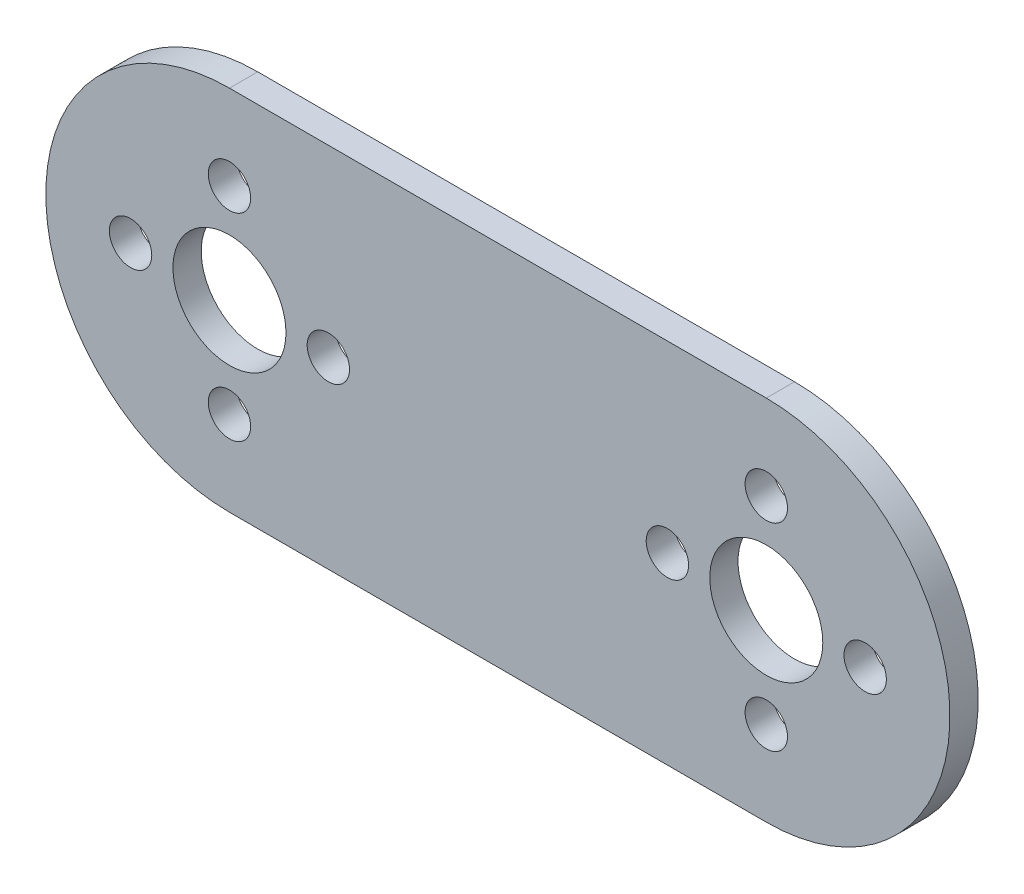
from build123d import *

# Parameters (mm, degrees)
SKETCH_1_R      = 4
SKETCH_1_R_2    = 1.5
EXTRUDE_1_DEPTH = 2


with BuildPart() as part:
    # 草图1 → 凸台-拉伸1 (new body)
    with BuildSketch(Plane.XY):
        with BuildLine():
            Line((-19, -13), (19, -13))
            ThreePointArc((19, -13), (32, 0), (19, 13))
            Line((19, 13), (-19, 13))
            ThreePointArc((-19, 13), (-32, 0), (-19, -13))
        make_face()
        with Locations((-19, 0)):
            Circle(SKETCH_1_R, mode=Mode.SUBTRACT)
        with Locations((19, 0)):
            Circle(SKETCH_1_R, mode=Mode.SUBTRACT)
        with Locations((-19, 7)):
            Circle(SKETCH_1_R_2, mode=Mode.SUBTRACT)
        with Locations((19, 7)):
            Circle(SKETCH_1_R_2, mode=Mode.SUBTRACT)
        with Locations((-12, 0)):
            Circle(SKETCH_1_R_2, mode=Mode.SUBTRACT)
        with Locations((-19, -7)):
            Circle(SKETCH_1_R_2, mode=Mode.SUBTRACT)
        with Locations((-26, 0)):
            Circle(SKETCH_1_R_2, mode=Mode.SUBTRACT)
        with Locations((26, 0)):
            Circle(SKETCH_1_R_2, mode=Mode.SUBTRACT)
        with Locations((19, -7)):
            Circle(SKETCH_1_R_2, mode=Mode.SUBTRACT)
        with Locations((12, 0)):
            Circle(SKETCH_1_R_2, mode=Mode.SUBTRACT)
    extrude(amount=EXTRUDE_1_DEPTH)


solid = part.part
